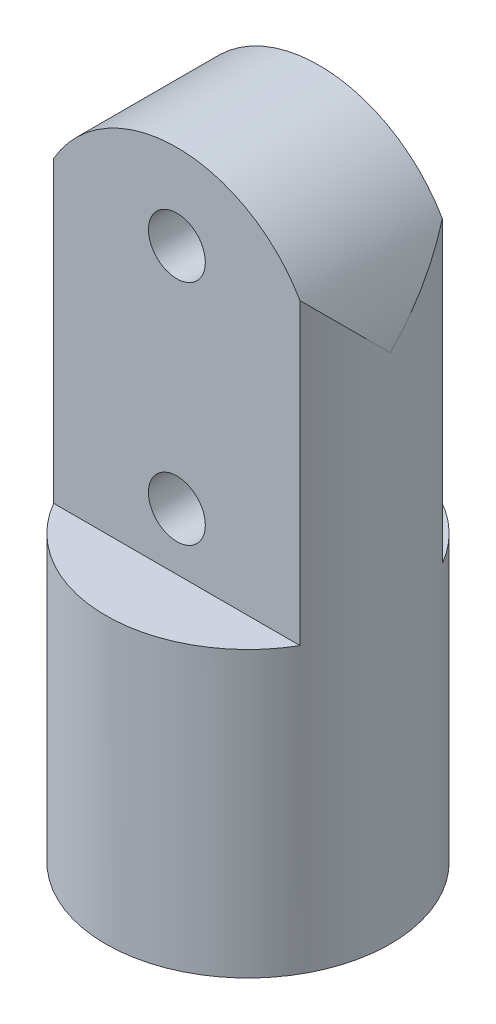
from build123d import *

# Parameters (mm, degrees)
SKETCH_1_R          = 25
SKETCH_1_R_2        = 10
EXTRUDE_1_DEPTH     = 50
EXTRUDE_2_DEPTH     = 12.5
CUT_EXTRUDE_1_DEPTH = 74.993242935
SKETCH_5_R          = 5
CUT_EXTRUDE_2_DEPTH = 124.51619327


with BuildPart() as part:
    # 草图1 → 凸台-拉伸1 (new body)
    with BuildSketch(Plane(origin=(0, 0, 0), x_dir=(1, 0, 0), z_dir=(0, 1, 0))):
        with Locations(Location((0, 0, 0), (0, 0, 270))):
            Circle(SKETCH_1_R)
        with Locations(Location((0, 0, 0), (0, 0, 270))):
            Circle(SKETCH_1_R_2, mode=Mode.SUBTRACT)
    extrude(amount=EXTRUDE_1_DEPTH)

    # 草图2 → 凸台-拉伸2 (add, symmetric)
    with BuildSketch(Plane.XY):
        with BuildLine():
            Line((-25, 50), (25, 50))
            Line((25, 50), (25, 90))
            ThreePointArc((25, 90), (0, 115), (-25, 90))
            Line((-25, 90), (-25, 50))
        make_face()
    extrude(amount=EXTRUDE_2_DEPTH, both=True)

    # 草图4 → 切除-拉伸1 (cut, through all)
    with BuildSketch(Plane.XZ.offset(-50)):
        with BuildLine():
            Line((21.650635095, -12.5), (25, -12.5))
            Line((25, -12.5), (25, 0))
            ThreePointArc((25, 0), (24.148145657, -6.470476128), (21.650635095, -12.5))
        make_face()
        with BuildLine():
            ThreePointArc((21.650635095, 12.5), (24.148145657, 6.470476128), (25, 0))
            Line((25, 0), (25, 12.5))
            Line((25, 12.5), (21.650635095, 12.5))
        make_face()
        with BuildLine():
            Line((-25, 0), (-25, -12.5))
            Line((-25, -12.5), (-21.650635095, -12.5))
            ThreePointArc((-21.650635095, -12.5), (-24.148145657, -6.470476128), (-25, 0))
        make_face()
        with BuildLine():
            Line((-25, 12.5), (-25, 0))
            ThreePointArc((-25, 0), (-24.148145657, 6.470476128), (-21.650635095, 12.5))
            Line((-21.650635095, 12.5), (-25, 12.5))
        make_face()
    extrude(amount=-CUT_EXTRUDE_1_DEPTH, mode=Mode.SUBTRACT)

    # 草图5 → 切除-拉伸2 (cut, through all)
    with BuildSketch(Plane.XY.offset(12.5)):
        with Locations((0, 100)):
            Circle(SKETCH_5_R)
        with Locations((0, 60)):
            Circle(SKETCH_5_R)
    extrude(amount=-CUT_EXTRUDE_2_DEPTH, mode=Mode.SUBTRACT)


solid = part.part
